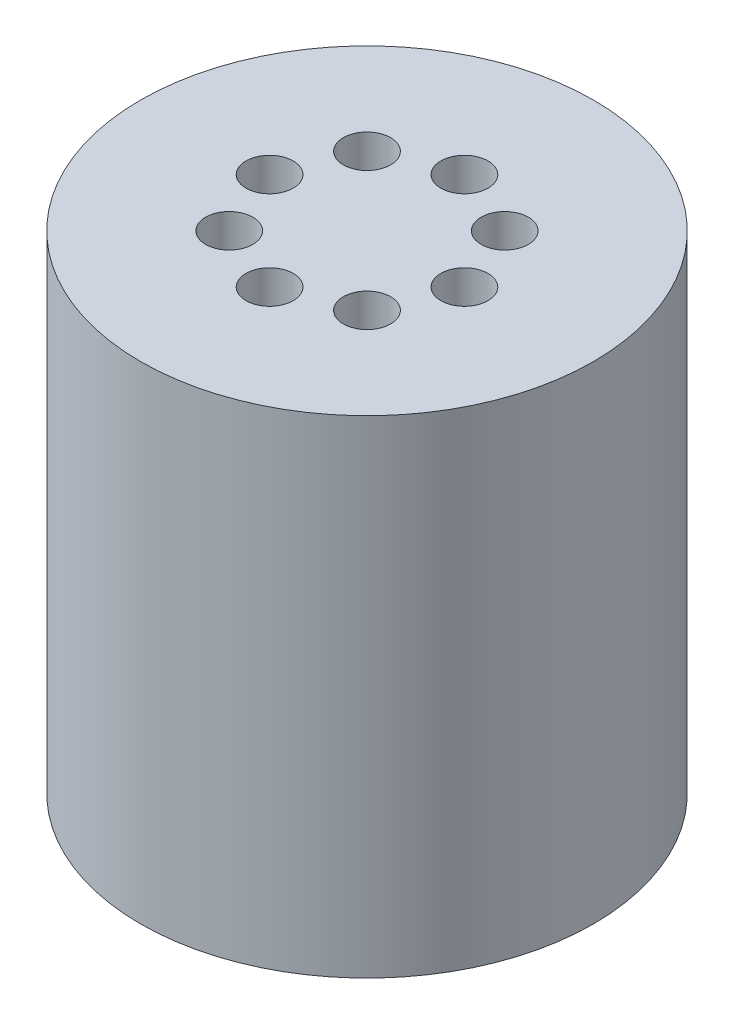
from build123d import *

# Parameters (mm, degrees)
SKETCH1_R           = 23.25
BOSS_EXTRUDE1_DEPTH = 50
SKETCH2_R           = 2.425
CUT_EXTRUDE1_DEPTH  = 5


with BuildPart() as part:
    # Sketch1 → Boss-Extrude1 (new body)
    with BuildSketch(Plane(origin=(0, 0, 0), x_dir=(1, 0, 0), z_dir=(0, 1, 0))):
        with Locations(Location((0, 0, 0), (0, 0, 270))):
            Circle(SKETCH1_R)
    extrude(amount=BOSS_EXTRUDE1_DEPTH)

    # Sketch2 → Cut-Extrude1 (cut)
    with BuildSketch(Plane(origin=(0, 50, 0), x_dir=(1, 0, 0), z_dir=(0, 1, 0))):
        with Locations(Location((0, 10, 0), (0, 0, 270))):
            Circle(SKETCH2_R)
        with Locations(Location((7.071067812, 7.071067812, 0), (0, 0, 270))):
            Circle(SKETCH2_R)
        with Locations(Location((10, 0, 0), (0, 0, 270))):
            Circle(SKETCH2_R)
        with Locations(Location((7.071067812, -7.071067812, 0), (0, 0, 270))):
            Circle(SKETCH2_R)
        with Locations(Location((0, -10, 0), (0, 0, 270))):
            Circle(SKETCH2_R)
        with Locations(Location((-7.071067812, -7.071067812, 0), (0, 0, 270))):
            Circle(SKETCH2_R)
        with Locations(Location((-10, 0, 0), (0, 0, 270))):
            Circle(SKETCH2_R)
        with Locations(Location((-7.071067812, 7.071067812, 0), (0, 0, 270))):
            Circle(SKETCH2_R)
    extrude(amount=-CUT_EXTRUDE1_DEPTH, mode=Mode.SUBTRACT)


solid = part.part
